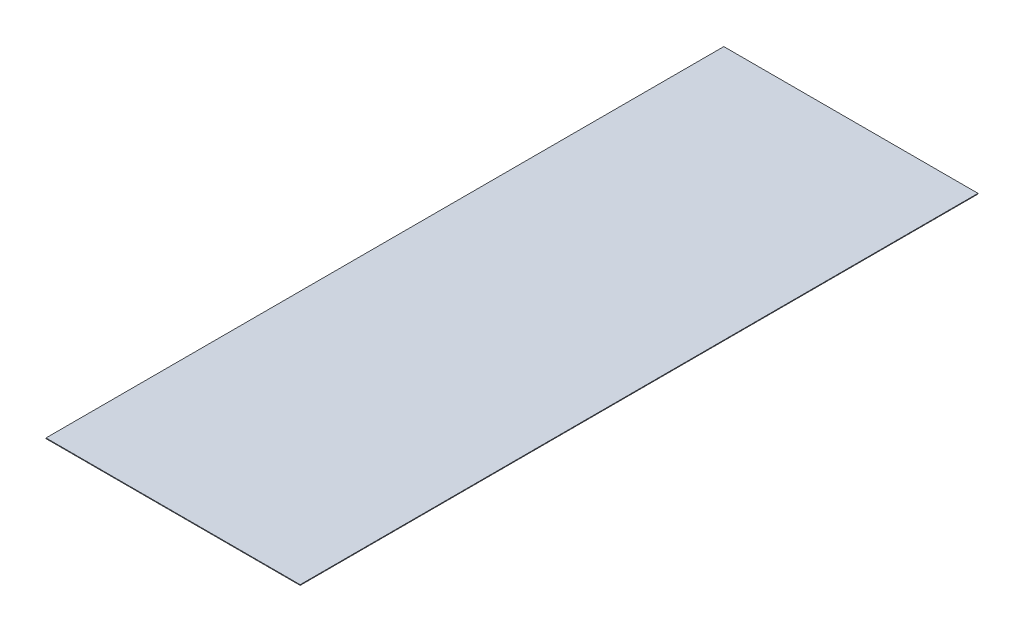
from build123d import *

# Parameters (mm, degrees)
CROQUIS1_W              = 914.4
CROQUIS1_H              = 2438.4
SALIENTE_EXTRUIR1_DEPTH = 2.3


with BuildPart() as part:
    # Croquis1 → Saliente-Extruir1 (new body)
    with BuildSketch(Plane(origin=(0, 0, 0), x_dir=(1, 0, 0), z_dir=(0, 1, 0))):
        Rectangle(CROQUIS1_W, CROQUIS1_H)
    extrude(amount=SALIENTE_EXTRUIR1_DEPTH)


solid = part.part
